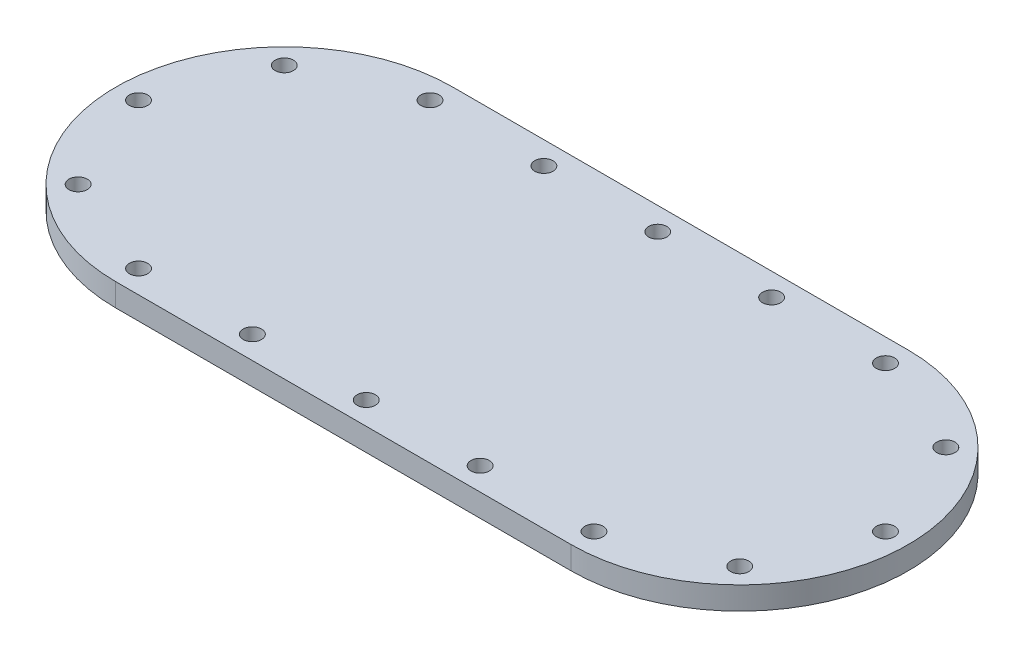
from build123d import *

# Parameters (mm, degrees)
SKETCH1_R           = 2.5527
BOSS_EXTRUDE1_DEPTH = 6.35


with BuildPart() as part:
    # Sketch1 → Boss-Extrude1 (new body)
    with BuildSketch(Plane(origin=(0, 0, 0), x_dir=(1, 0, 0), z_dir=(0, 1, 0))):
        with BuildLine():
            Line((-63.5, 46.99), (63.5, 46.99))
            ThreePointArc((63.5, 46.99), (110.49, 0), (63.5, -46.99))
            Line((63.5, -46.99), (-63.5, -46.99))
            ThreePointArc((-63.5, -46.99), (-110.49, 0), (-63.5, 46.99))
        make_face()
        with Locations(Location((-63.5, 40.64, 0), (0, 0, 270))):
            Circle(SKETCH1_R, mode=Mode.SUBTRACT)
        with Locations(Location((-31.75, 40.64, 0), (0, 0, 270))):
            Circle(SKETCH1_R, mode=Mode.SUBTRACT)
        with Locations(Location((0, 40.64, 0), (0, 0, 270))):
            Circle(SKETCH1_R, mode=Mode.SUBTRACT)
        with Locations(Location((31.75, 40.64, 0), (0, 0, 270))):
            Circle(SKETCH1_R, mode=Mode.SUBTRACT)
        with Locations(Location((63.5, 40.64, 0), (0, 0, 270))):
            Circle(SKETCH1_R, mode=Mode.SUBTRACT)
        with Locations(Location((92.236819587, 28.736819587, 0), (0, 0, 270))):
            Circle(SKETCH1_R, mode=Mode.SUBTRACT)
        with Locations(Location((104.14, 0, 0), (0, 0, 270))):
            Circle(SKETCH1_R, mode=Mode.SUBTRACT)
        with Locations(Location((92.236819587, -28.736819587, 0), (0, 0, 270))):
            Circle(SKETCH1_R, mode=Mode.SUBTRACT)
        with Locations(Location((63.5, -40.64, 0), (0, 0, 270))):
            Circle(SKETCH1_R, mode=Mode.SUBTRACT)
        with Locations(Location((-92.236819587, 28.736819587, 0), (0, 0, 270))):
            Circle(SKETCH1_R, mode=Mode.SUBTRACT)
        with Locations(Location((-104.14, 0, 0), (0, 0, 270))):
            Circle(SKETCH1_R, mode=Mode.SUBTRACT)
        with Locations(Location((-92.236819587, -28.736819587, 0), (0, 0, 270))):
            Circle(SKETCH1_R, mode=Mode.SUBTRACT)
        with Locations(Location((-63.5, -40.64, 0), (0, 0, 270))):
            Circle(SKETCH1_R, mode=Mode.SUBTRACT)
        with Locations(Location((31.75, -40.64, 0), (0, 0, 270))):
            Circle(SKETCH1_R, mode=Mode.SUBTRACT)
        with Locations(Location((0, -40.64, 0), (0, 0, 270))):
            Circle(SKETCH1_R, mode=Mode.SUBTRACT)
        with Locations(Location((-31.75, -40.64, 0), (0, 0, 270))):
            Circle(SKETCH1_R, mode=Mode.SUBTRACT)
    extrude(amount=BOSS_EXTRUDE1_DEPTH)


solid = part.part
